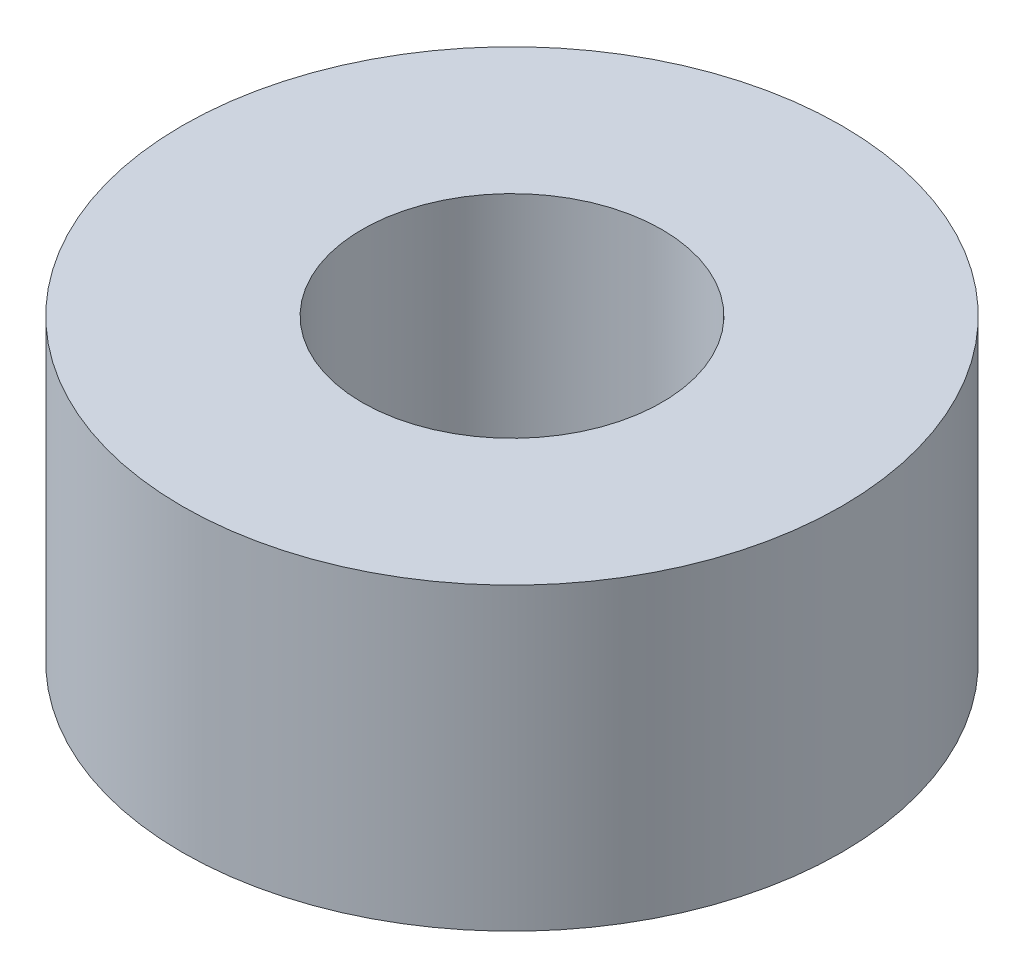
from build123d import *

# Parameters (mm, degrees)
SKETCH1_R           = 8.73125
SKETCH1_R_2         = 3.96875
BOSS_EXTRUDE1_DEPTH = 3.96875


with BuildPart() as part:
    # Sketch1 → Boss-Extrude1 (new, symmetric)
    with BuildSketch(Plane(origin=(0, 0, 0), x_dir=(1, 0, 0), z_dir=(0, 1, 0))):
        with Locations(Location((0, 0, 0), (0, 0, 270))):
            Circle(SKETCH1_R)
        with Locations(Location((0, 0, 0), (0, 0, 270))):
            Circle(SKETCH1_R_2, mode=Mode.SUBTRACT)
    extrude(amount=BOSS_EXTRUDE1_DEPTH, both=True)


solid = part.part
